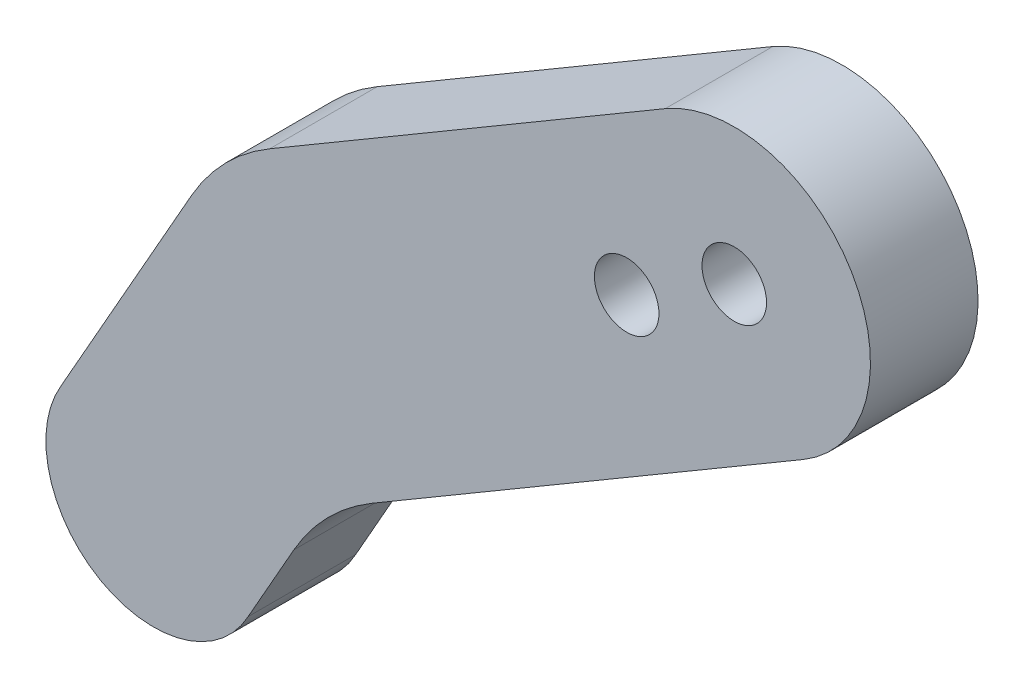
from build123d import *

# Parameters (mm, degrees)
BOSS_EXTRUDE1_DEPTH = 5
SKETCH4_R           = 1.5
CUT_EXTRUDE1_DEPTH  = 7


with BuildPart() as part:
    # Sketch3 → Boss-Extrude1 (new body)
    with BuildSketch(Plane.XY):
        with BuildLine():
            Line((0, 0), (6.076429876, 10.717831833))
            ThreePointArc((6.076429876, 10.717831833), (7.649333388, 12.801292724), (9.707880871, 14.406664022))
            Line((9.707880871, 14.406664022), (28.087855737, 25.211319894))
            ThreePointArc((28.087855737, 25.211319894), (36.75286592, 22.962183463), (34.503729489, 14.297173281))
            Line((34.503729489, 14.297173281), (14.461489972, 2.51535625))
            ThreePointArc((14.461489972, 2.51535625), (12.402942489, 0.909984953), (10.830038977, -1.173475938))
            Line((10.830038977, -1.173475938), (8.699180072, -4.931963714))
            ThreePointArc((8.699180072, -4.931963714), (1.838948591, -6.894344126), (0, 0))
        make_face()
    extrude(amount=BOSS_EXTRUDE1_DEPTH)

    # Sketch4 → Cut-Extrude1 (cut)
    with BuildSketch(Plane.XY.offset(5)):
        with Locations((31.295792613, 19.754246587)):
            Circle(SKETCH4_R)
        with Locations((26.295792613, 16.814999948)):
            Circle(SKETCH4_R)
    extrude(amount=-CUT_EXTRUDE1_DEPTH, mode=Mode.SUBTRACT)


solid = part.part
